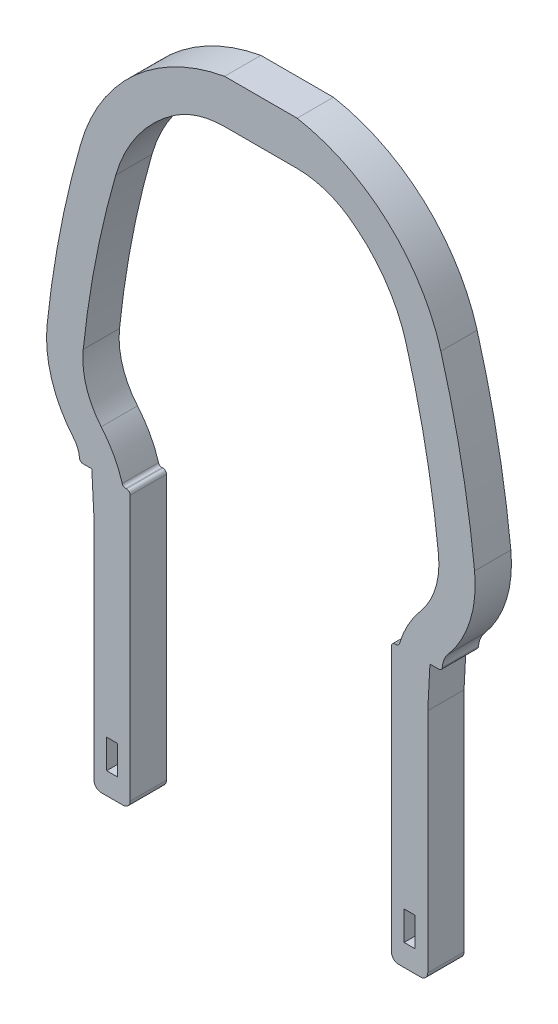
from build123d import *
from OCP.BRepFilletAPI import BRepFilletAPI_MakeChamfer

# Parameters (mm, degrees)
SKETCH1_W           = 1.5
SKETCH1_H           = 4
BOSS_EXTRUDE2_DEPTH = 5
FILLET1_R           = 0.5
CHAMFER1_SIZE       = 0.3
CHAMFER1_SIZE2      = 5.724341006
FILLET2_R           = 1


with BuildPart() as part:
    # Sketch1 → Boss-Extrude2 (new body)
    with BuildSketch(Plane.XY):
        with BuildLine():
            Line((-23, 0), (-23, -38))
            Line((-23, -38), (-18, -38))
            Line((-18, -38), (-18, 0))
            Line((-18, 0), (-19, 0))
            ThreePointArc((-19, 0), (-20.189073449, 2.999867677), (-22, 5.670756438))
            ThreePointArc((-22, 5.670756438), (-24.059928624, 9.416545723), (-24.479374077, 13.670756438))
            ThreePointArc((-24.479374077, 13.670756438), (-22.747220808, 25.287873584), (-20, 36.707617169))
            ThreePointArc((-20, 36.707617169), (-16.964694879, 42.959375039), (-12, 47.822435639))
            ThreePointArc((-12, 47.822435639), (-8.665439487, 49.443039718), (-5, 50))
            Line((-5, 50), (0, 50))
            Line((0, 50), (5, 50))
            ThreePointArc((5, 50), (8.665439487, 49.443039718), (12, 47.822435639))
            ThreePointArc((12, 47.822435639), (16.964694879, 42.959375039), (20, 36.707617169))
            ThreePointArc((20, 36.707617169), (22.747220808, 25.287873584), (24.479374077, 13.670756438))
            ThreePointArc((24.479374077, 13.670756438), (24.059928624, 9.416545723), (22, 5.670756438))
            ThreePointArc((22, 5.670756438), (20.189073449, 2.999867677), (19, 0))
            Line((19, 0), (18, 0))
            Line((18, 0), (18, -38))
            Line((18, -38), (23, -38))
            Line((23, -38), (23, 0))
            Line((23, 0), (25, 0))
            ThreePointArc((25, 0), (25.167645284, 1.293755366), (25.807904166, 2.430406787))
            ThreePointArc((25.807904166, 2.430406787), (28.835820924, 7.936392778), (29.45236943, 14.189714259))
            ThreePointArc((29.45236943, 14.189714259), (27.655298376, 26.242218695), (24.805116996, 38.089952388))
            ThreePointArc((24.805116996, 38.089952388), (21.022828669, 45.88025678), (14.836331188, 51.940107967))
            ThreePointArc((14.836331188, 51.940107967), (10.13388043, 54.492689205), (5, 56))
            Line((5, 56), (-5, 56))
            ThreePointArc((-5, 56), (-10.13388043, 54.492689205), (-14.836331188, 51.940107967))
            ThreePointArc((-14.836331188, 51.940107967), (-21.022828669, 45.88025678), (-24.805116996, 38.089952388))
            ThreePointArc((-24.805116996, 38.089952388), (-27.655298376, 26.242218695), (-29.45236943, 14.189714259))
            ThreePointArc((-29.45236943, 14.189714259), (-28.835820924, 7.936392778), (-25.807904166, 2.430406787))
            ThreePointArc((-25.807904166, 2.430406787), (-25.167645284, 1.293755366), (-25, 0))
            Line((-25, 0), (-23, 0))
        make_face()
        with Locations((-20.5, -33)):
            Rectangle(SKETCH1_W, SKETCH1_H, mode=Mode.SUBTRACT)
        with Locations((20.5, -33)):
            Rectangle(SKETCH1_W, SKETCH1_H, mode=Mode.SUBTRACT)
    extrude(amount=BOSS_EXTRUDE2_DEPTH)

    # Fillet1
    fillet1_edges = [part.edges().sort_by_distance(p)[0] for p in [
        (-25, 0, 2.5),
        (25, 0, 2.5),
        (18, 0, 2.5),
        (19, 0, 2.5),
        (-19, 0, 2.5),
        (-18, 0, 2.5),
    ]]
    fillet(fillet1_edges, radius=FILLET1_R)

    # Chamfer1: one chamfer whose edges measure the first distance from different faces: ONE call of the kernel's chamfer builder (chamfer() names one face for all edges)
    chamfer1_edges_1 = [part.edges().sort_by_distance(p)[0] for p in [
        (-23, 0, 2.5),
    ]]
    chamfer1_side_1 = [part.faces().sort_by_distance(p)[0] for p in [
        (-23.751749754, 0, 2.5),
    ]]
    chamfer1_edges_2 = [part.edges().sort_by_distance(p)[0] for p in [
        (23, 0, 2.5),
    ]]
    chamfer1_side_2 = [part.faces().sort_by_distance(p)[0] for p in [
        (23.751749754, 0, 2.5),
    ]]
    chamfer1 = BRepFilletAPI_MakeChamfer(part.part.solid().wrapped)
    for e in chamfer1_edges_1:
        chamfer1.Add(CHAMFER1_SIZE, CHAMFER1_SIZE2, e.wrapped, chamfer1_side_1[0].wrapped)  # the first distance lies on this face
    for e in chamfer1_edges_2:
        chamfer1.Add(CHAMFER1_SIZE, CHAMFER1_SIZE2, e.wrapped, chamfer1_side_2[0].wrapped)  # the first distance lies on this face
    add(Compound.cast(chamfer1.Shape()), mode=Mode.REPLACE)

    # Fillet2
    fillet2_edges = [part.edges().sort_by_distance(p)[0] for p in [
        (-18, -38, 2.5),
        (-23, -38, 2.5),
        (23, -38, 2.5),
        (18, -38, 2.5),
    ]]
    fillet(fillet2_edges, radius=FILLET2_R)


solid = part.part
